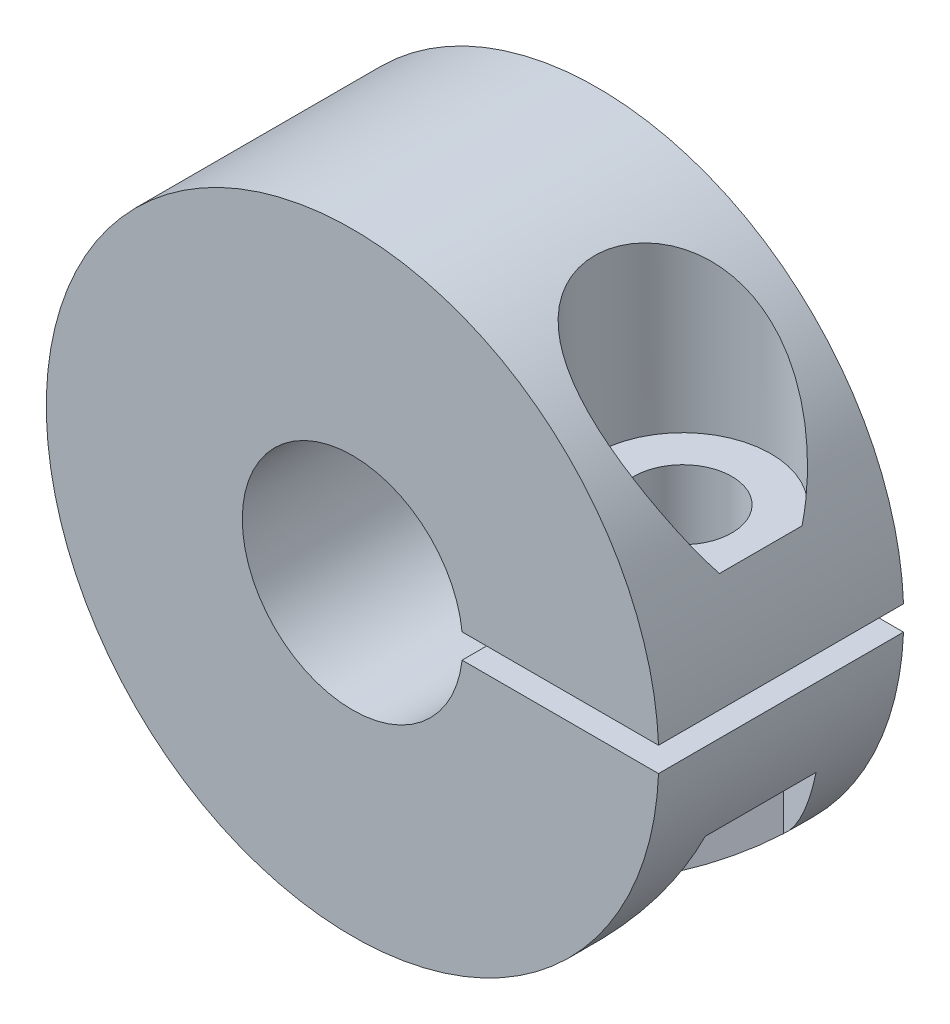
from build123d import *

# Parameters (mm, degrees)
SKETCH1_R               = 12.5
SKETCH1_R_2             = 4.5
BOSS_EXTRUDE1_DEPTH     = 10
SKETCH2_W               = 9.983536535
SKETCH2_H               = 1
CUT_EXTRUDE1_DEPTH      = 21.310096012
CUT_EXTRUDE2_DEPTH      = 21.310096012
CUT_EXTRUDE2_DEPTH_BACK = 21.310096012
SKETCH3_R               = 2
CUT_EXTRUDE3_REACH      = 25.351
SKETCH4_R               = 3.6
CUT_EXTRUDE4_REACH      = 25.351
CUT_EXTRUDE4_END_RADIUS = 12.5


with BuildPart() as part:
    # Sketch1 → Boss-Extrude1 (new body)
    with BuildSketch(Plane.XY):
        Circle(SKETCH1_R)
        Circle(SKETCH1_R_2, mode=Mode.SUBTRACT)
    extrude(amount=BOSS_EXTRUDE1_DEPTH)

    # Sketch2 → Cut-Extrude1 (cut, through all)
    with BuildSketch(Plane.XY.offset(10)):
        with Locations((8.497672296, 0)):
            Rectangle(SKETCH2_W, SKETCH2_H)
    extrude(amount=-CUT_EXTRUDE1_DEPTH, mode=Mode.SUBTRACT)

    # Sketch3 → Cut-Extrude2 (cut, two sides: drawn at the far end of the back side and taken through both)
    with BuildSketch(Plane(origin=(0, 0, 0), x_dir=(1, 0, 0), z_dir=(0, 1, 0)).offset(-CUT_EXTRUDE2_DEPTH_BACK)):
        with Locations(Location((8.481065976, -5, 0), (0, 0, 270))):
            Circle(SKETCH3_R)
    extrude(amount=CUT_EXTRUDE2_DEPTH + CUT_EXTRUDE2_DEPTH_BACK, mode=Mode.SUBTRACT)

    # Sketch4 → Cut-Extrude3 (cut, up to next)
    with BuildSketch(Plane(origin=(0, 4.5, 0), x_dir=(1, 0, 0), z_dir=(0, 1, 0)), mode=Mode.PRIVATE) as cut_extrude3_sk1:
        with Locations((8.481065976, -5)):
            Circle(SKETCH4_R)
    cut_extrude3_tool1 = extrude(cut_extrude3_sk1.sketch, amount=CUT_EXTRUDE3_REACH, mode=Mode.PRIVATE) & part.part
    add(cut_extrude3_tool1.solids().sort_by_distance((8.481066, 4.5, 5))[0], mode=Mode.SUBTRACT)

    # Cut-Extrude4: up to this cylinder (the profile starts inside it)
    cut_extrude4_end = Plane(origin=(0, 0, 5), z_dir=(0, 0, -1)) * Cylinder(CUT_EXTRUDE4_END_RADIUS, 76.702, mode=Mode.PRIVATE)
    # Sketch5 → Cut-Extrude4 (cut, up to the surface)
    with BuildSketch(Plane(origin=(0, -4.5, 0), x_dir=(1, 0, 0), z_dir=(0, 1, 0)), mode=Mode.PRIVATE) as cut_extrude4_sk1:
        Polygon((8.472706177, -9.099178387), (12.026878694, -7.056828991), (12.035238493, -2.957650604), (8.489425774, -0.900821613), (4.935253257, -2.943171009), (4.926893459, -7.042349396), align=None)
    cut_extrude4_tool1 = extrude(cut_extrude4_sk1.sketch, amount=-CUT_EXTRUDE4_REACH, mode=Mode.PRIVATE) & cut_extrude4_end
    add(cut_extrude4_tool1.solids().sort_by_distance((8.481066, -4.5, 5))[0], mode=Mode.SUBTRACT)


solid = part.part
